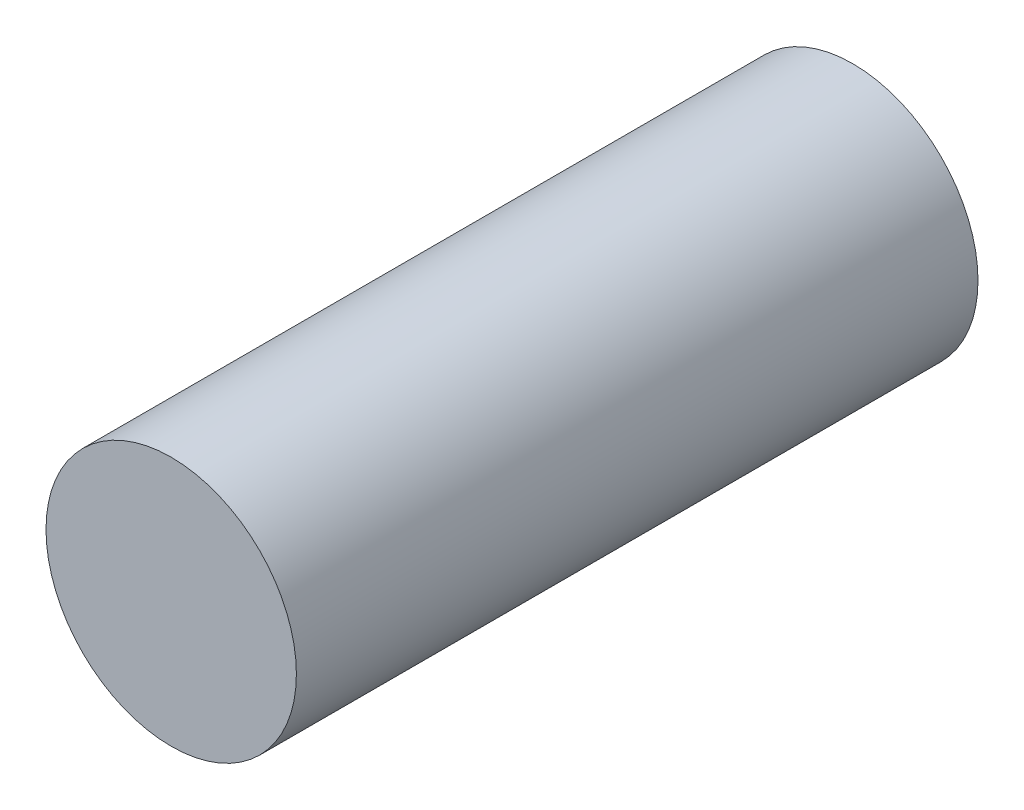
from build123d import *

# Parameters (mm, degrees)
SKETCH1_R           = 18
BOSS_EXTRUDE1_DEPTH = 98


with BuildPart() as part:
    # Sketch1 → Boss-Extrude1 (new body)
    with BuildSketch(Plane.XY):
        Circle(SKETCH1_R)
    extrude(amount=BOSS_EXTRUDE1_DEPTH)


solid = part.part
